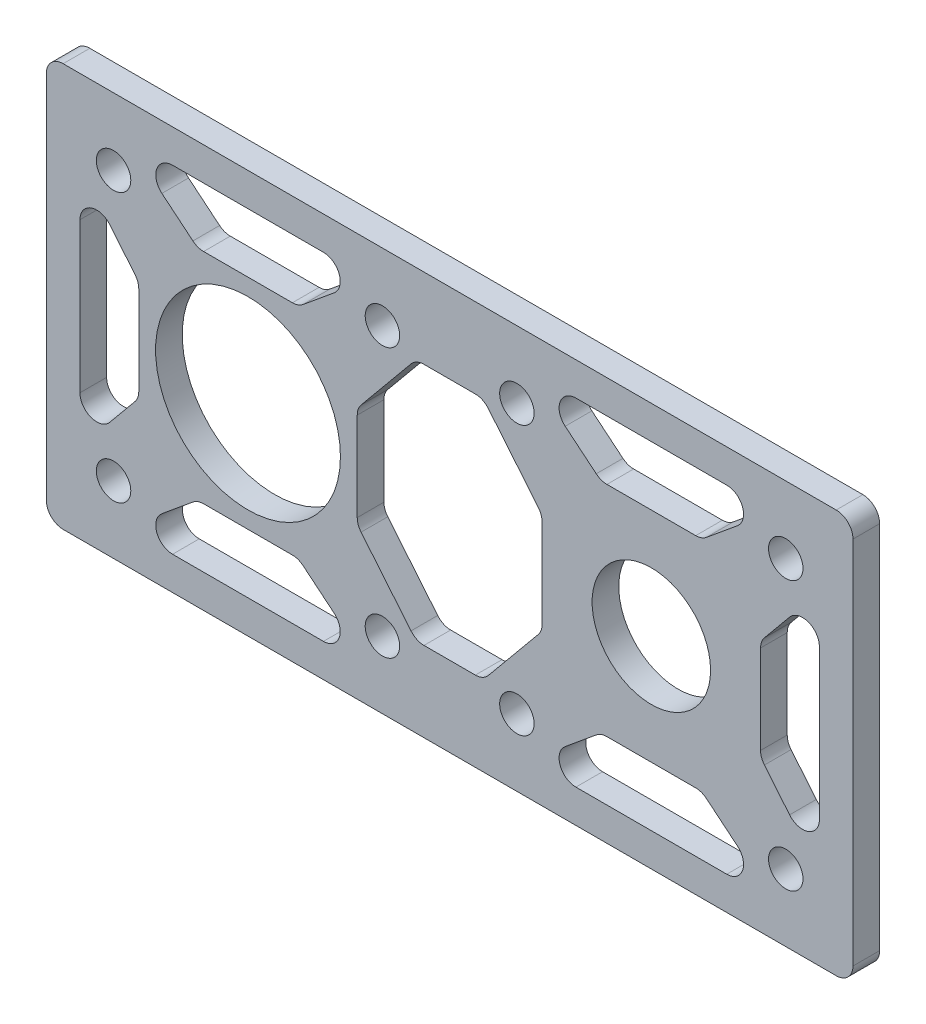
from build123d import *

# Parameters (mm, degrees)
SKETCH1_W           = 96
SKETCH1_H           = 48
SKETCH1_R           = 2.05
SKETCH1_R_2         = 11
SKETCH1_R_3         = 7.05
BOSS_EXTRUDE1_DEPTH = 3.175
FILLET1_R           = 2


with BuildPart() as part:
    # Sketch1 → Boss-Extrude1 (new body)
    with BuildSketch(Plane.XY):
        Rectangle(SKETCH1_W, SKETCH1_H)
        with Locations((-40, 16)):
            Circle(SKETCH1_R, mode=Mode.SUBTRACT)
        with Locations((-8, 16)):
            Circle(SKETCH1_R, mode=Mode.SUBTRACT)
        with Locations((-8, -16)):
            Circle(SKETCH1_R, mode=Mode.SUBTRACT)
        with Locations((-40, -16)):
            Circle(SKETCH1_R, mode=Mode.SUBTRACT)
        with Locations((-24, 0)):
            Circle(SKETCH1_R_2, mode=Mode.SUBTRACT)
        with Locations(Location((8, 16, 0), (0, 0, 180))):
            Circle(SKETCH1_R, mode=Mode.SUBTRACT)
        with Locations(Location((8, -16, 0), (0, 0, 180))):
            Circle(SKETCH1_R, mode=Mode.SUBTRACT)
        with Locations(Location((40, -16, 0), (0, 0, 180))):
            Circle(SKETCH1_R, mode=Mode.SUBTRACT)
        with Locations(Location((40, 16, 0), (0, 0, 180))):
            Circle(SKETCH1_R, mode=Mode.SUBTRACT)
        with Locations((24, 0)):
            Circle(SKETCH1_R_3, mode=Mode.SUBTRACT)
        Polygon((-38.544929421, 20.05), (-30, 13), (-18, 13), (-9.455070579, 20.05), align=None, mode=Mode.SUBTRACT)
        Polygon((-18, -13), (-9.455070579, -20.05), (-38.544929421, -20.05), (-30, -13), align=None, mode=Mode.SUBTRACT)
        Polygon((-11, -6), (-11, 6), (-4, 14.484327085), (4, 14.484327085), (11, 6), (11, -6), (4, -14.484327085), (-4, -14.484327085), align=None, mode=Mode.SUBTRACT)
        Polygon((30, -13), (18, -13), (9.455070579, -20.05), (38.544929421, -20.05), align=None, mode=Mode.SUBTRACT)
        Polygon((37, -6), (37, 6), (44, 14.484327085), (44, -14.484327085), align=None, mode=Mode.SUBTRACT)
        Polygon((18, 13), (9.455070579, 20.05), (38.544929421, 20.05), (30, 13), align=None, mode=Mode.SUBTRACT)
        Polygon((-44, -14.484327085), (-37, -6), (-37, 6), (-44, 14.484327085), align=None, mode=Mode.SUBTRACT)
    extrude(amount=BOSS_EXTRUDE1_DEPTH)

    # Fillet1
    fillet1_edges = [part.edges().sort_by_distance(p)[0] for p in [
        (38.544929421, -20.05, 1.5875),
        (30, -13, 1.5875),
        (18, -13, 1.5875),
        (9.455070579, -20.05, 1.5875),
        (37, -6, 1.5875),
        (44, -14.484327085, 1.5875),
        (44, 14.484327085, 1.5875),
        (37, 6, 1.5875),
        (18, 13, 1.5875),
        (30, 13, 1.5875),
        (38.544929421, 20.05, 1.5875),
        (9.455070579, 20.05, 1.5875),
        (-9.455070579, 20.05, 1.5875),
        (-38.544929421, 20.05, 1.5875),
        (-30, 13, 1.5875),
        (-18, 13, 1.5875),
        (-11, -6, 1.5875),
        (-4, -14.484327085, 1.5875),
        (4, -14.484327085, 1.5875),
        (11, -6, 1.5875),
        (11, 6, 1.5875),
        (4, 14.484327085, 1.5875),
        (-4, 14.484327085, 1.5875),
        (-11, 6, 1.5875),
        (-37, -6, 1.5875),
        (-37, 6, 1.5875),
        (-44, 14.484327085, 1.5875),
        (-44, -14.484327085, 1.5875),
        (-48, 24, 1.5875),
        (48, 24, 1.5875),
        (48, -24, 1.5875),
        (-48, -24, 1.5875),
        (-18, -13, 1.5875),
        (-30, -13, 1.5875),
        (-38.544929421, -20.05, 1.5875),
        (-9.455070579, -20.05, 1.5875),
    ]]
    fillet(fillet1_edges, radius=FILLET1_R)


solid = part.part
